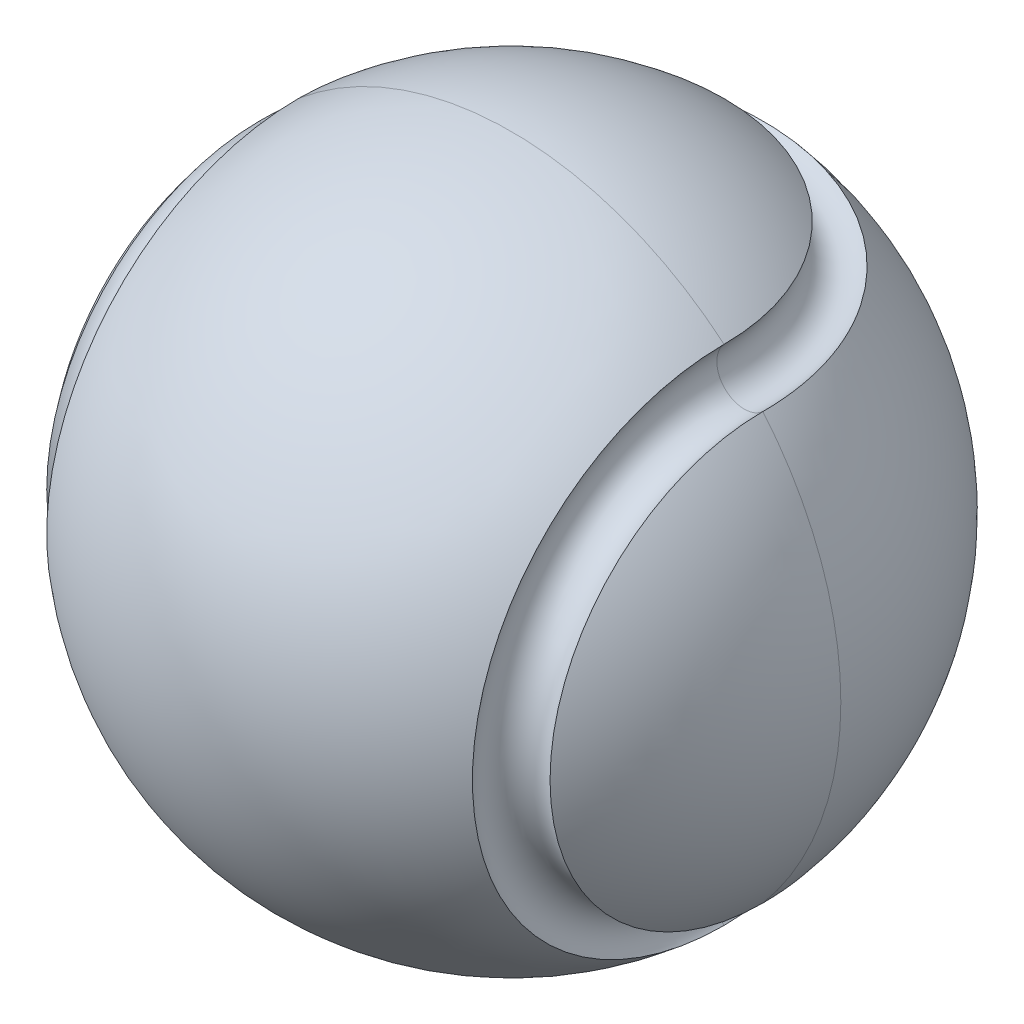
from build123d import *

# Parameters (mm, degrees)
CUT_SWEEP1_PROFILE_R = 6.35


with BuildPart() as part:
    # Sketch1 → Revolve1 (revolve)
    with BuildSketch(Plane.XY):
        with BuildLine():
            Line((-76.2, 0), (76.2, 0))
            ThreePointArc((76.2, 0), (0, 76.2), (-76.2, 0))
        make_face()
    revolve(axis=Axis((-76.2, 0, 0), (1, 0, 0)))

    # Cut-Sweep1: sweep along a curve in space
    with BuildLine() as cut_sweep1_path:
        ThreePointArc((53.881536726, 53.881536726, 0), (0, 53.881536726, -53.881536726), (-53.881536726, 53.881536726, 0))
        ThreePointArc((-53.881536726, 53.881536726, 0), (-53.881536726, 0, 53.881536726), (-53.881536726, -53.881536726, 0))
        ThreePointArc((-53.881536726, -53.881536726, 0), (0, -53.881536726, -53.881536726), (53.881536726, -53.881536726, 0))
        ThreePointArc((53.881536726, -53.881536726, 0), (53.881536726, 0, 53.881536726), (53.881536726, 53.881536726, 0))
    # Cut-Sweep1 profile (on start of the path) → Cut-Sweep1 (sweep, cut)
    with BuildSketch(Plane(origin=(53.881536726, 53.881536726, 0), x_dir=(0, -1, 0), z_dir=(0, 0, -1))):
        Circle(CUT_SWEEP1_PROFILE_R)
    sweep(path=cut_sweep1_path.line, mode=Mode.SUBTRACT)


solid = part.part
